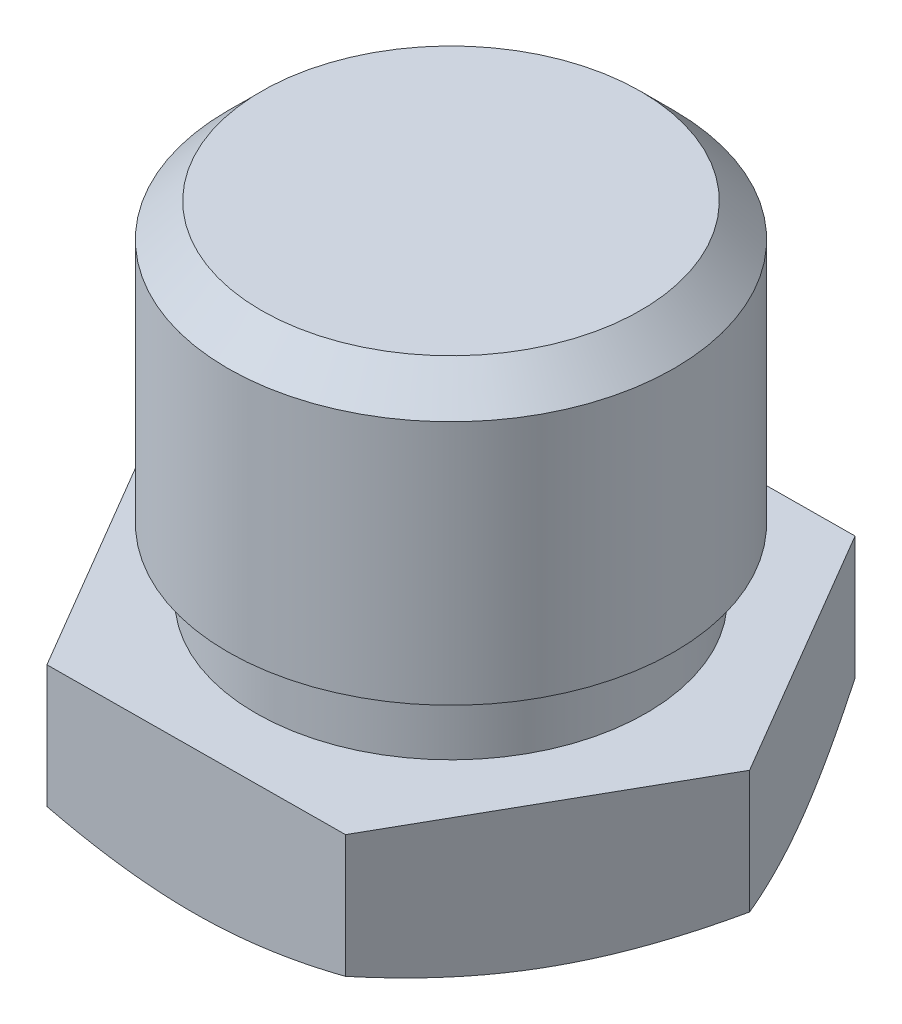
from build123d import *

# Parameters (mm, degrees)
EXTRUDE_1_DEPTH = 6.5
SKETCH_2_R      = 8.75
EXTRUDE_2_DEPTH = 3
SKETCH_3_R      = 10
EXTRUDE_3_DEPTH = 12.5
CHAMFER_1_SIZE  = 1.5


with BuildPart() as part:
    # 草图1 → 凸台-拉伸1 (new body)
    with BuildSketch(Plane(origin=(0, 0, 0), x_dir=(1, 0, 0), z_dir=(0, 1, 0))):
        Polygon((6.553289027, 11.549360859), (-6.725395388, 11.449995205), (-13.278684415, -0.099365654), (-6.553289027, -11.549360859), (6.725395388, -11.449995205), (13.278684415, 0.099365654), align=None)
    extrude(amount=EXTRUDE_1_DEPTH)

    # 草图2 → 凸台-拉伸2 (add)
    with BuildSketch(Plane(origin=(0, 6.5, 0), x_dir=(1, 0, 0), z_dir=(0, 1, 0))):
        with Locations(Location((0, 0, 0), (0, 0, 270))):
            Circle(SKETCH_2_R)
    extrude(amount=EXTRUDE_2_DEPTH)

    # 草图3 → 凸台-拉伸3 (add)
    with BuildSketch(Plane(origin=(0, 9.5, 0), x_dir=(1, 0, 0), z_dir=(0, 1, 0))):
        with Locations(Location((0, 0, 0), (0, 0, 270))):
            Circle(SKETCH_3_R)
    extrude(amount=EXTRUDE_3_DEPTH)

    # 倒角1
    chamfer_1_edges = [part.edges().sort_by_distance(p)[0] for p in [
        (0, 22, -10),
    ]]
    chamfer(chamfer_1_edges, length=CHAMFER_1_SIZE)

    # 草图5 → 切除-旋转3 (revolve, cut)
    with BuildSketch(Plane(origin=(0, 0, 0), x_dir=(0.49350563267132574, 0, -0.8697426001534446), z_dir=(0.8697426001534445, 0, 0.4935056326713257)), mode=Mode.PRIVATE) as cut_revolve_3_sk:
        Polygon((13.279056191, 1), (11.279056191, 0), (13.279056191, 0), align=None)
    revolve(cut_revolve_3_sk.sketch.rotate(Axis((0, -1000, 0), (0, 1, 0)), 180.000000003), axis=Axis((0, -1000, 0), (0, 1, 0)), mode=Mode.SUBTRACT)


solid = part.part
